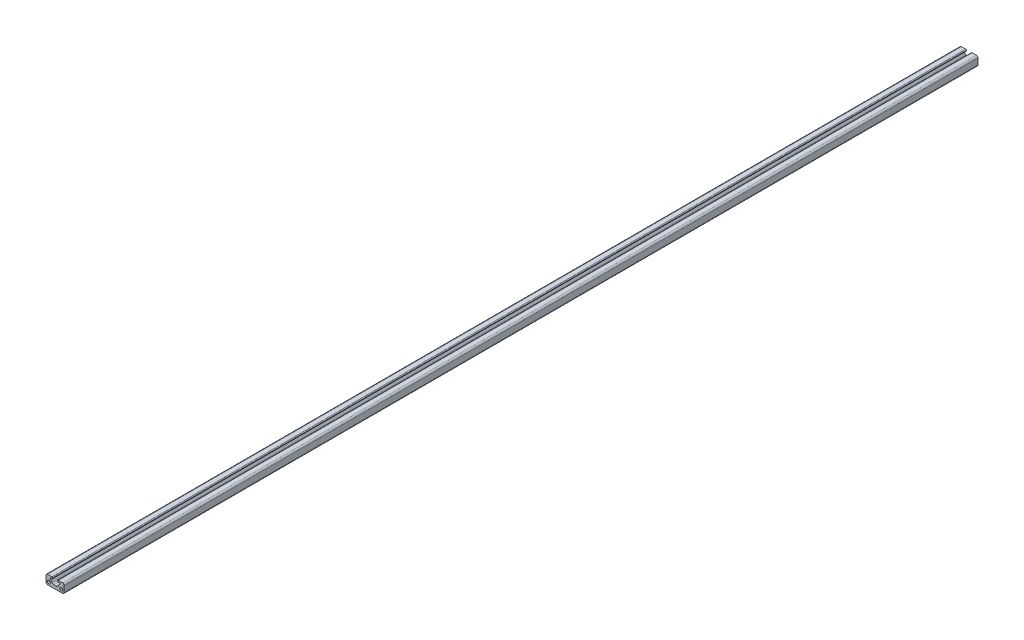
from build123d import *

# Parameters (mm, degrees)
SKETCH1_R           = 2
BOSS_EXTRUDE2_DEPTH = 1257.3
FILLET1_R           = 1.065
FILLET4_R           = 2.13
FILLET5_R           = 2.13
FILLET8_R           = 0.5325
FILLET11_R          = 0.5325
FILLET15_R          = 3
FILLET16_R          = 3


with BuildPart() as part:
    # Sketch1 → Boss-Extrude2 (new body)
    with BuildSketch(Plane.XY):
        Polygon((7.345, 3.97), (3.25, -1.87), (-3.25, -1.87), (-7.345, 3.97), (-3.25, 3.97), (-3.25, 6.25), (-12.5, 6.25), (-12.5, -6.25), (12.5, -6.25), (12.5, 6.25), (3.25, 6.25), (3.25, 3.97), align=None)
        with Locations((-8.5, -2.25)):
            Circle(SKETCH1_R, mode=Mode.SUBTRACT)
        with Locations((8.5, -2.25)):
            Circle(SKETCH1_R, mode=Mode.SUBTRACT)
    extrude(amount=BOSS_EXTRUDE2_DEPTH)

    # Fillet1
    fillet1_edges = [part.edges().sort_by_distance(p)[0] for p in [
        (3.25, 3.97, 628.65),
        (3.25, 6.25, 628.65),
        (-3.25, 6.25, 628.65),
        (-3.25, 3.97, 628.65),
    ]]
    fillet(fillet1_edges, radius=FILLET1_R)

    # Fillet4
    fillet4_edges = [part.edges().sort_by_distance(p)[0] for p in [
        (12.5, 6.25, 628.65),
    ]]
    fillet(fillet4_edges, radius=FILLET4_R)

    # Fillet5
    fillet5_edges = [part.edges().sort_by_distance(p)[0] for p in [
        (12.5, -6.25, 628.65),
        (-12.5, -6.25, 628.65),
        (-12.5, 6.25, 628.65),
    ]]
    fillet(fillet5_edges, radius=FILLET5_R)

    # Fillet8
    fillet8_edges = [part.edges().sort_by_distance(p)[0] for p in [
        (7.345, 3.97, 628.65),
    ]]
    fillet(fillet8_edges, radius=FILLET8_R)

    # Fillet11
    fillet11_edges = [part.edges().sort_by_distance(p)[0] for p in [
        (-7.345, 3.97, 628.65),
    ]]
    fillet(fillet11_edges, radius=FILLET11_R)

    # Fillet15
    fillet15_edges = [part.edges().sort_by_distance(p)[0] for p in [
        (-3.25, -1.87, 628.65),
    ]]
    fillet(fillet15_edges, radius=FILLET15_R)

    # Fillet16
    fillet16_edges = [part.edges().sort_by_distance(p)[0] for p in [
        (3.25, -1.87, 628.65),
    ]]
    fillet(fillet16_edges, radius=FILLET16_R)


solid = part.part
